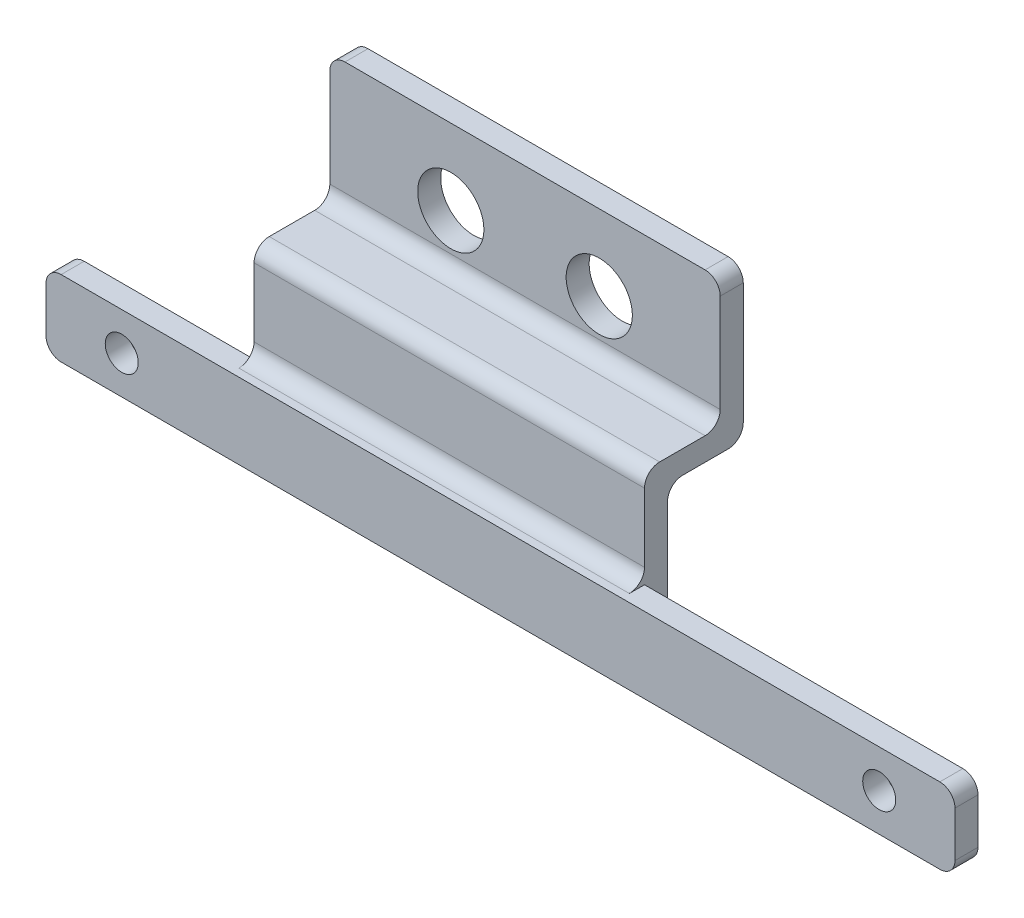
from build123d import *

# Parameters (mm, degrees)
SKETCH1_W           = 25.77
SKETCH1_H           = 10
SKETCH1_R           = 2.185
BOSS_EXTRUDE1_DEPTH = 1.52
SKETCH2_W           = 25.77
SKETCH2_H           = 1.52
BOSS_EXTRUDE2_DEPTH = 5
SKETCH3_W           = 25.77
SKETCH3_H           = 1.52
BOSS_EXTRUDE3_DEPTH = 10
BOSS_EXTRUDE4_DEPTH = 1.52
SKETCH5_R           = 1.09
CUT_EXTRUDE1_DEPTH  = 5
FILLET1_R           = 1


with BuildPart() as part:
    # Sketch1 → Boss-Extrude1 (new body)
    with BuildSketch(Plane.XY):
        Rectangle(SKETCH1_W, SKETCH1_H)
        with Locations((-4.9, 0)):
            Circle(SKETCH1_R, mode=Mode.SUBTRACT)
        with Locations((4.9, 0)):
            Circle(SKETCH1_R, mode=Mode.SUBTRACT)
    extrude(amount=BOSS_EXTRUDE1_DEPTH)

    # Sketch2 → Boss-Extrude2 (add)
    with BuildSketch(Plane.XY.offset(1.52)):
        with Locations((0, -4.24)):
            Rectangle(SKETCH2_W, SKETCH2_H)
    extrude(amount=BOSS_EXTRUDE2_DEPTH)

    # Sketch3 → Boss-Extrude3 (add)
    with BuildSketch(Plane(origin=(0, -5, 0), x_dir=(-1, 0, 0), z_dir=(0, -1, 0))):
        with Locations((0, -5.76)):
            Rectangle(SKETCH3_W, SKETCH3_H)
    extrude(amount=BOSS_EXTRUDE3_DEPTH)

    # Sketch4 → Boss-Extrude4 (add)
    with BuildSketch(Plane.XY.offset(6.52)):
        Polygon((-12.885, -15), (-25.1, -15), (-25.1, -10), (34.9, -10), (34.9, -15), align=None)
    extrude(amount=BOSS_EXTRUDE4_DEPTH)

    # Sketch5 → Cut-Extrude1 (cut, symmetric)
    with BuildSketch(Plane.XY.offset(6.52)):
        with Locations(Location((-20.1, -12.5, 0), (0, 0, 180))):
            Circle(SKETCH5_R)
        with Locations(Location((29.9, -12.5, 0), (0, 0, 180))):
            Circle(SKETCH5_R)
    extrude(amount=CUT_EXTRUDE1_DEPTH, both=True, mode=Mode.SUBTRACT)

    # Fillet1
    fillet1_edges = [part.edges().sort_by_distance(p)[0] for p in [
        (0, -5, 0),
        (0, -5, 5),
        (-25.1, -15, 7.28),
        (-25.1, -10, 7.28),
        (34.9, -15, 7.28),
        (34.9, -10, 7.28),
        (0, -10, 6.52),
        (0, -3.48, 6.52),
        (0, -3.48, 1.52),
        (-12.885, 5, 0.76),
        (12.885, 5, 0.76),
        (0, -15, 5),
    ]]
    fillet(fillet1_edges, radius=FILLET1_R)


solid = part.part
